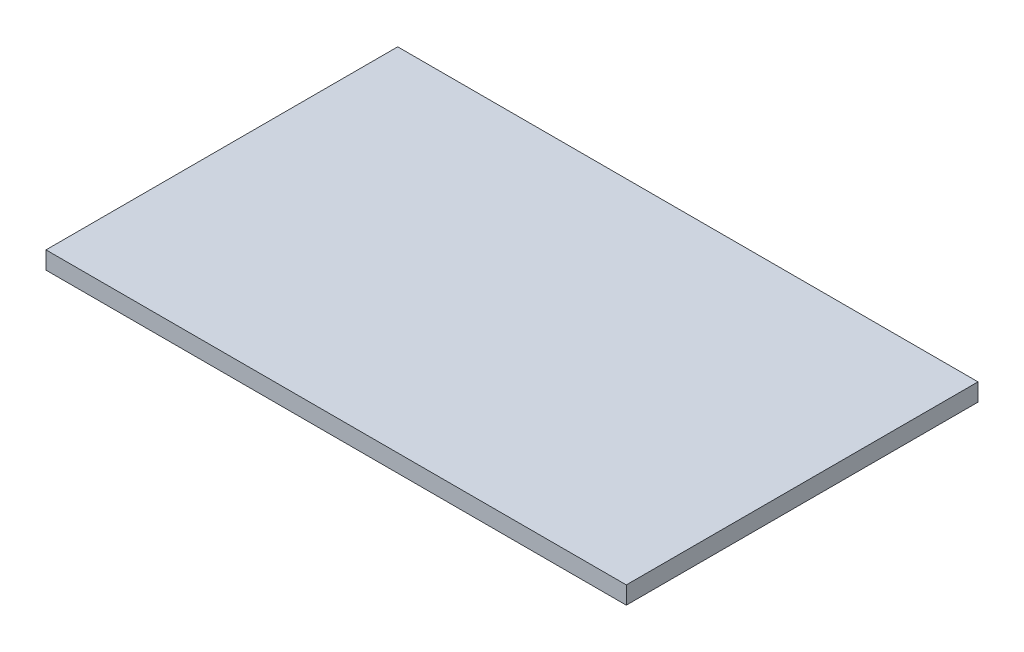
from build123d import *

# Parameters (mm, degrees)
ESQUISSE1_W        = 3.3
ESQUISSE1_H        = 2
BOSS_EXTRU_1_DEPTH = 0.1


with BuildPart() as part:
    # Esquisse1 → Boss.-Extru.1 (new body)
    with BuildSketch(Plane(origin=(0, 0, 0), x_dir=(1, 0, 0), z_dir=(0, 1, 0))):
        Rectangle(ESQUISSE1_W, ESQUISSE1_H)
    extrude(amount=BOSS_EXTRU_1_DEPTH)


solid = part.part
